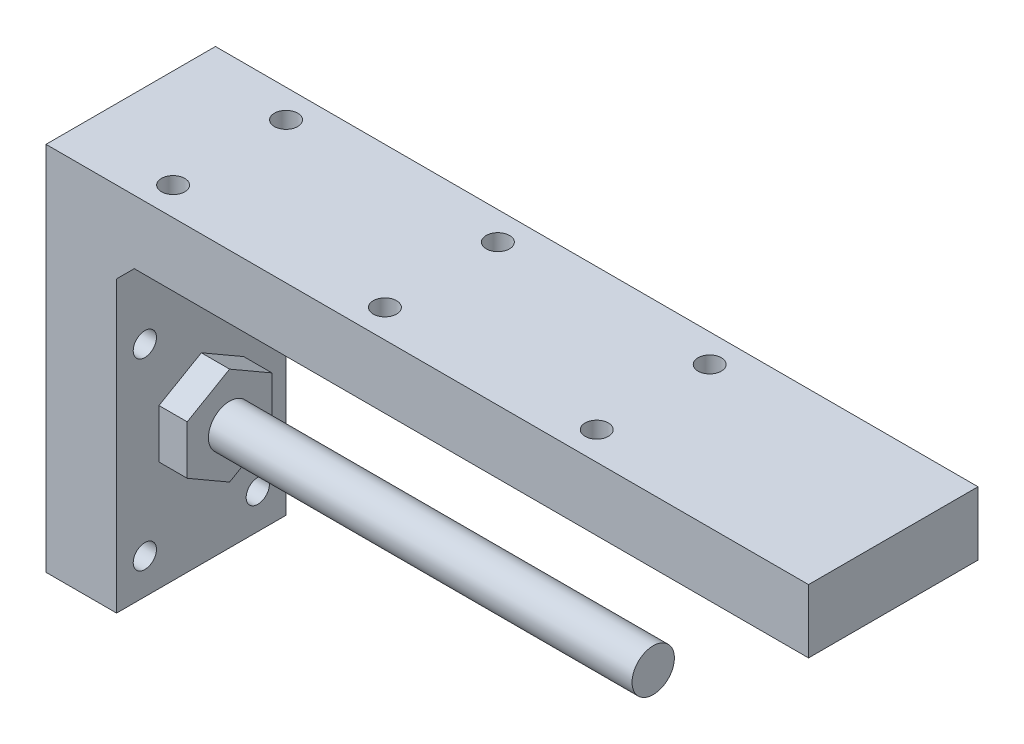
from build123d import *

# Parameters (mm, degrees)
BOSS_EXTRUDE1_DEPTH       = 24
CHAMFER1_SIZE             = 2.5
BOSS_EXTRUDE2_DEPTH       = 4
SKETCH3_R                 = 3
BOSS_EXTRUDE3_DEPTH       = 60
M4X0_7_TAPPED_HOLE1_D     = 3.3
M4X0_7_TAPPED_HOLE1_DEPTH = 10.1
M4X0_7_TAPPED_HOLE1_TIP   = 0.991420021
M4X0_7_TAPPED_HOLE2_D     = 3.3
M4X0_7_TAPPED_HOLE2_DEPTH = 10.1
M4X0_7_TAPPED_HOLE2_TIP   = 0.991420021


with BuildPart() as part:
    # Sketch1 → Boss-Extrude1 (new body)
    with BuildSketch(Plane.XY):
        Polygon((0, 0), (0, 52.5), (108, 52.5), (108, 43.5), (10, 43.5), (10, 0), align=None)
    extrude(amount=BOSS_EXTRUDE1_DEPTH)

    # Chamfer1
    chamfer1_edges = [part.edges().sort_by_distance(p)[0] for p in [
        (10, 43.5, 12),
    ]]
    chamfer(chamfer1_edges, length=CHAMFER1_SIZE)

    # Sketch2 → Boss-Extrude2 (add)
    with BuildSketch(Plane(origin=(10, 0, 0), x_dir=(0, 0, -1), z_dir=(1, 0, 0))):
        Polygon((-6, 22.464101615), (-12, 25.92820323), (-18, 22.464101615), (-18, 15.535898385), (-12, 12.07179677), (-6, 15.535898385), align=None)
    extrude(amount=BOSS_EXTRUDE2_DEPTH)

    # Sketch3 → Boss-Extrude3 (add)
    with BuildSketch(Plane(origin=(14, 0, 0), x_dir=(0, 0, -1), z_dir=(1, 0, 0))):
        with Locations(Location((-12, 19, 0), (0, 0, 90))):
            Circle(SKETCH3_R)
    extrude(amount=BOSS_EXTRUDE3_DEPTH)

    # M4x0.7 Tapped Hole1
    with Locations(Plane(origin=(0, 52.5, 0), x_dir=(1, 0, 0), z_dir=(0, 1, 0))):
        with Locations((14, -4), (44, -4), (74, -4), (74, -20), (44, -20), (14, -20)):
            Hole(M4X0_7_TAPPED_HOLE1_D / 2, depth=M4X0_7_TAPPED_HOLE1_DEPTH)
            with Locations((0, 0, -(M4X0_7_TAPPED_HOLE1_DEPTH + M4X0_7_TAPPED_HOLE1_TIP / 2))):  # 118° drill point
                Cone(0, M4X0_7_TAPPED_HOLE1_D / 2, M4X0_7_TAPPED_HOLE1_TIP, mode=Mode.SUBTRACT)

    # M4x0.7 Tapped Hole2
    with Locations(Plane.ZY):
        with Locations((4, 31), (20, 31), (20, 5), (4, 5)):
            Hole(M4X0_7_TAPPED_HOLE2_D / 2, depth=M4X0_7_TAPPED_HOLE2_DEPTH)
            with Locations((0, 0, -(M4X0_7_TAPPED_HOLE2_DEPTH + M4X0_7_TAPPED_HOLE2_TIP / 2))):  # 118° drill point
                Cone(0, M4X0_7_TAPPED_HOLE2_D / 2, M4X0_7_TAPPED_HOLE2_TIP, mode=Mode.SUBTRACT)


solid = part.part
